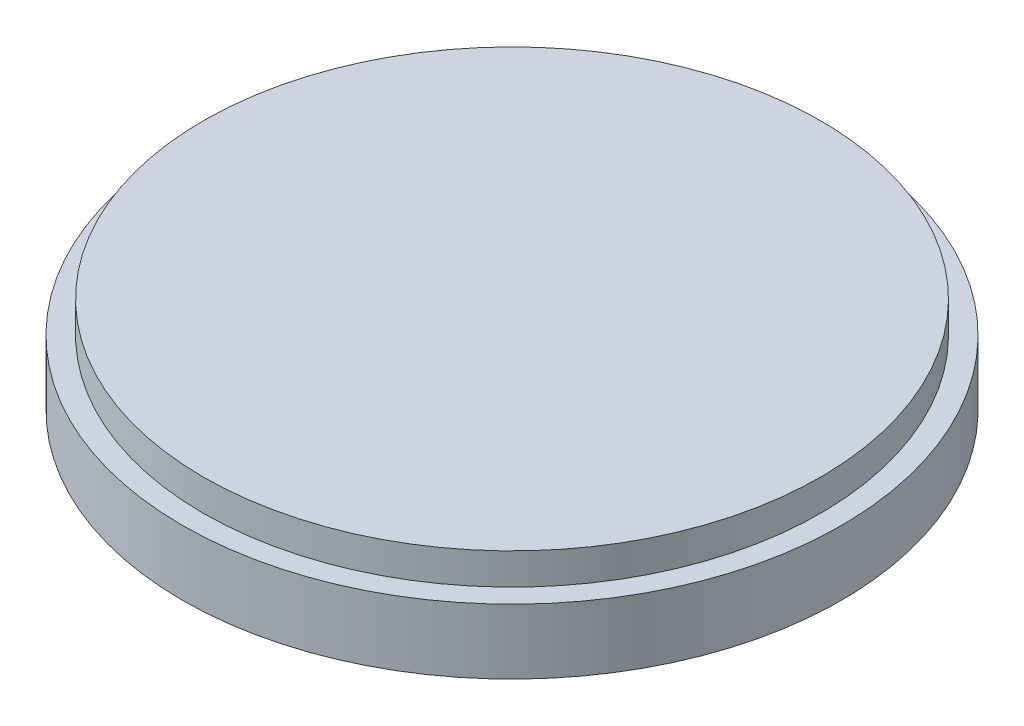
from build123d import *

# Parameters (mm, degrees)
M3_CLEARANCE_HOLE1_D     = 3.4
M3_CLEARANCE_HOLE1_DEPTH = 4
M3_CLEARANCE_HOLE1_TIP   = 1.021463052
SKETCH5_R                = 29.5
BOSS_EXTRUDE1_DEPTH      = 3


with BuildPart() as part:
    # Sketch1 → Revolve1 (revolve)
    with BuildSketch(Plane.XY, mode=Mode.PRIVATE) as revolve1_sk:
        Polygon((-26.5, -7.6), (-31.5, -6.2), (-31.5, 0), (0, 0), (0, -7.6), align=None)
    revolve(revolve1_sk.sketch.rotate(Axis((0, -13.2, 0), (0, 1, 0)), 270), axis=Axis((0, -13.2, 0), (0, 1, 0)))

    # M3 Clearance Hole1
    with Locations(Plane(origin=(0, -7.6, 0), x_dir=(-1, 0, 0), z_dir=(0, -1, 0))):
        with Locations((15.556349186, -15.556349186), (15.556349186, 15.556349186), (-15.556349186, 15.556349186), (-15.556349186, -15.556349186)):
            Hole(M3_CLEARANCE_HOLE1_D / 2, depth=M3_CLEARANCE_HOLE1_DEPTH)
            with Locations((0, 0, -(M3_CLEARANCE_HOLE1_DEPTH + M3_CLEARANCE_HOLE1_TIP / 2))):  # 118° drill point
                Cone(0, M3_CLEARANCE_HOLE1_D / 2, M3_CLEARANCE_HOLE1_TIP, mode=Mode.SUBTRACT)

    # Sketch5 → Boss-Extrude1 (add)
    with BuildSketch(Plane(origin=(0, 0, 0), x_dir=(1, 0, 0), z_dir=(0, 1, 0))):
        with Locations(Location((0, 0, 0), (0, 0, 270))):
            Circle(SKETCH5_R)
    extrude(amount=BOSS_EXTRUDE1_DEPTH)


solid = part.part
